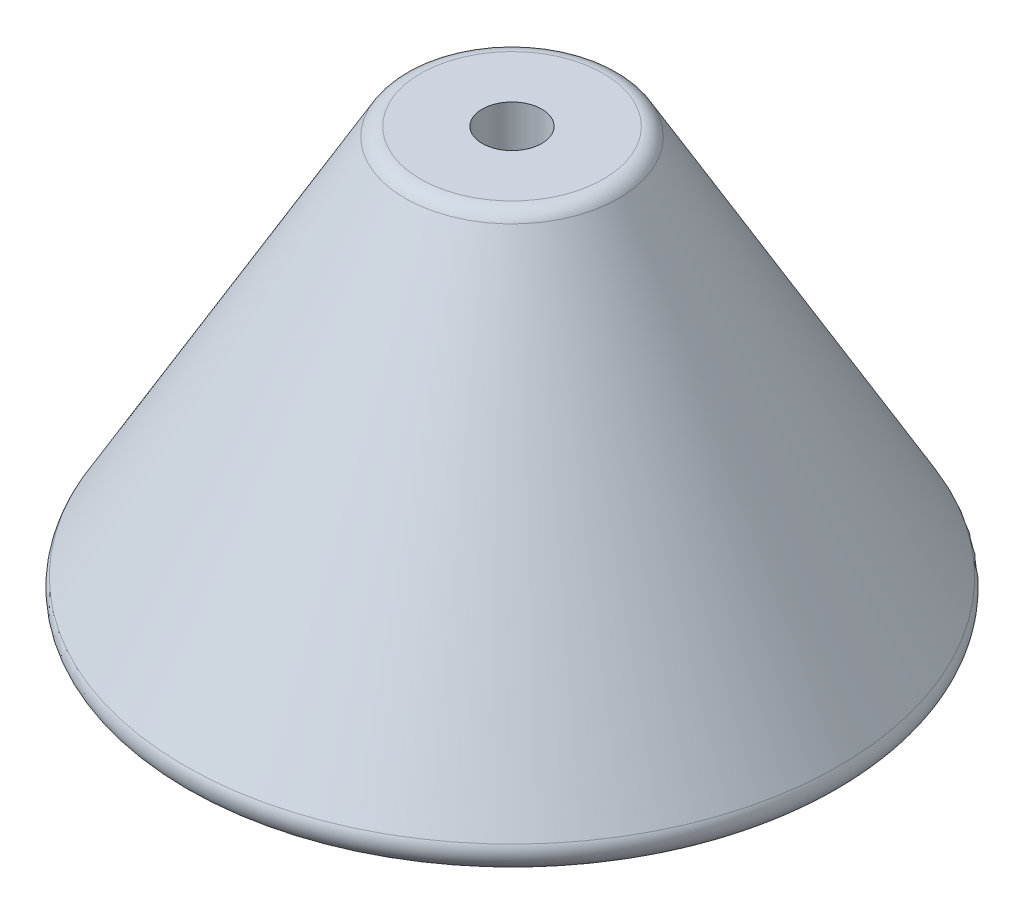
from build123d import *

# Parameters (mm, degrees)
SKETCH1_R           = 57.5
BOSS_EXTRUDE1_DEPTH = 70
BOSS_EXTRUDE1_TAPER = 30
SKETCH3_R           = 5
CUT_EXTRUDE2_DEPTH  = 108.296318842
FILLET1_R           = 3


with BuildPart() as part:
    # Sketch1 → Boss-Extrude1 (new body)
    with BuildSketch(Plane(origin=(0, 0, 0), x_dir=(1, 0, 0), z_dir=(0, 1, 0))):
        Circle(SKETCH1_R)
    extrude(amount=BOSS_EXTRUDE1_DEPTH, taper=BOSS_EXTRUDE1_TAPER)

    # Sketch3 → Cut-Extrude2 (cut, through all)
    with BuildSketch(Plane.XZ):
        with Locations(Location((0, 0, 0), (0, 0, 270))):
            Circle(SKETCH3_R)
    extrude(amount=-CUT_EXTRUDE2_DEPTH, mode=Mode.SUBTRACT)

    # Fillet1
    fillet1_edges = [part.edges().sort_by_distance(p)[0] for p in [
        (-57.5, 0, 0),
        (-17.085481157, 70, 0),
    ]]
    fillet(fillet1_edges, radius=FILLET1_R)


solid = part.part
